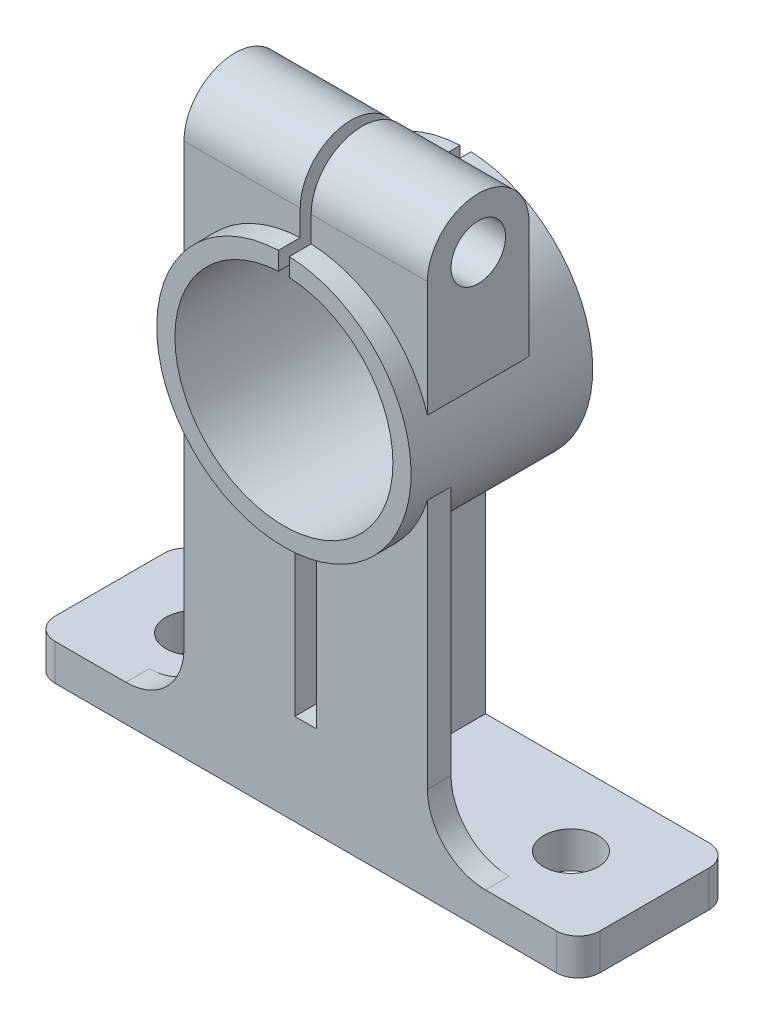
from build123d import *

# Parameters (mm, degrees)
SKETCH1_R           = 35
SKETCH1_R_2         = 30
BOSS_EXTRUDE1_DEPTH = 50
SKETCH4_W           = 150
SKETCH4_H           = 10
BOSS_EXTRUDE3_DEPTH = 42
BOSS_EXTRUDE5_START = -6.5
BOSS_EXTRUDE5_DEPTH = 6.5
FILLET1_R           = 16
SKETCH8_W           = 35.5
SKETCH8_H           = 64.245534278
BOSS_EXTRUDE6_DEPTH = 7.5
SKETCH9_W           = 6
SKETCH9_H           = 45
CUT_EXTRUDE1_DEPTH  = 137.330480818
SKETCH10_R          = 7.5
BOSS_EXTRUDE8_DEPTH = 67
CUT_EXTRUDE3_START  = -67
SKETCH12_R          = 30
CUT_EXTRUDE3_DEPTH  = 67
SKETCH13_W          = 3
SKETCH13_H          = 51.427571889
CUT_EXTRUDE4_DEPTH  = 67
SKETCH15_R          = 7.5
CUT_EXTRUDE5_DEPTH  = 113
FILLET2_R           = 6


with BuildPart() as part:
    # Sketch1 → Boss-Extrude1 (new body)
    with BuildSketch(Plane.XY):
        Circle(SKETCH1_R)
        Circle(SKETCH1_R_2, mode=Mode.SUBTRACT)
    extrude(amount=BOSS_EXTRUDE1_DEPTH)



with BuildPart() as body_2:
    # Sketch4 → Boss-Extrude3 (new body)
    with BuildSketch(Plane.XY.offset(2)):
        with Locations((0, -100)):
            Rectangle(SKETCH4_W, SKETCH4_H)
    extrude(amount=BOSS_EXTRUDE3_DEPTH)


with BuildPart() as part_1:
    add(part.part)

    add(body_2.part)  # Boss-Extrude5 merges body 2
    # Sketch5 → Boss-Extrude5 (add)
    with BuildSketch(Plane.XY.offset(44).offset(BOSS_EXTRUDE5_START)):
        with BuildLine():
            Line((-33.5, -10.136567466), (-33.5, -95))
            Line((-33.5, -95), (33.5, -95))
            Line((33.5, -95), (33.5, -10.136567466))
            ThreePointArc((33.5, -10.136567466), (0, -35), (-33.5, -10.136567466))
        make_face()
    extrude(amount=BOSS_EXTRUDE5_DEPTH)

    # Fillet1
    fillet1_edges = [part_1.edges().sort_by_distance(p)[0] for p in [
        (33.5, -95, 40.75),
        (-33.5, -95, 40.75),
    ]]
    fillet(fillet1_edges, radius=FILLET1_R)

    # Sketch8 → Boss-Extrude6 (add, symmetric)
    with BuildSketch(Plane(origin=(0, 0, 0), x_dir=(0, 0, -1), z_dir=(1, 0, 0))):
        with Locations((-19.75, -62.877232861)):
            Rectangle(SKETCH8_W, SKETCH8_H)
    extrude(amount=BOSS_EXTRUDE6_DEPTH, both=True)

    # Sketch9 → Cut-Extrude1 (cut, through all)
    with BuildSketch(Plane.XY.offset(44)):
        with Locations((0, -57.371191548)):
            Rectangle(SKETCH9_W, SKETCH9_H)
    extrude(amount=-CUT_EXTRUDE1_DEPTH, mode=Mode.SUBTRACT)

    # Sketch10 → Boss-Extrude8 (add)
    with BuildSketch(Plane(origin=(33.5, 0, 0), x_dir=(0, 0, -1), z_dir=(1, 0, 0))):
        with BuildLine():
            Line((-44, 42), (-44, 7))
            Line((-44, 7), (-16, 7))
            Line((-16, 7), (-16, 42))
            ThreePointArc((-16, 42), (-30, 56), (-44, 42))
        make_face()
        with Locations((-30, 42)):
            Circle(SKETCH10_R, mode=Mode.SUBTRACT)
    extrude(amount=-BOSS_EXTRUDE8_DEPTH)

    # Sketch12 → Cut-Extrude3 (cut)
    with BuildSketch(Plane.XY.offset(44).offset(CUT_EXTRUDE3_START)):
        Circle(SKETCH12_R)
    extrude(amount=CUT_EXTRUDE3_DEPTH, mode=Mode.SUBTRACT)

    # Sketch13 → Cut-Extrude4 (cut)
    with BuildSketch(Plane.XY.offset(50)):
        with Locations((0, 34.305367012)):
            Rectangle(SKETCH13_W, SKETCH13_H)
    extrude(amount=-CUT_EXTRUDE4_DEPTH, mode=Mode.SUBTRACT)

    # Sketch15 → Cut-Extrude5 (cut)
    with BuildSketch(Plane(origin=(0, 0, 0), x_dir=(1, 0, 0), z_dir=(0, 1, 0))):
        with Locations(Location((-52, -23, 0), (0, 0, 270))):
            Circle(SKETCH15_R)
        with Locations(Location((52, -23, 0), (0, 0, 270))):
            Circle(SKETCH15_R)
    extrude(amount=-CUT_EXTRUDE5_DEPTH, mode=Mode.SUBTRACT)

    # Fillet2
    fillet2_edges = [part_1.edges().sort_by_distance(p)[0] for p in [
        (-75, -100, 2),
        (75, -100, 2),
        (-75, -100, 44),
        (75, -100, 44),
    ]]
    fillet(fillet2_edges, radius=FILLET2_R)


solid = part_1.part
